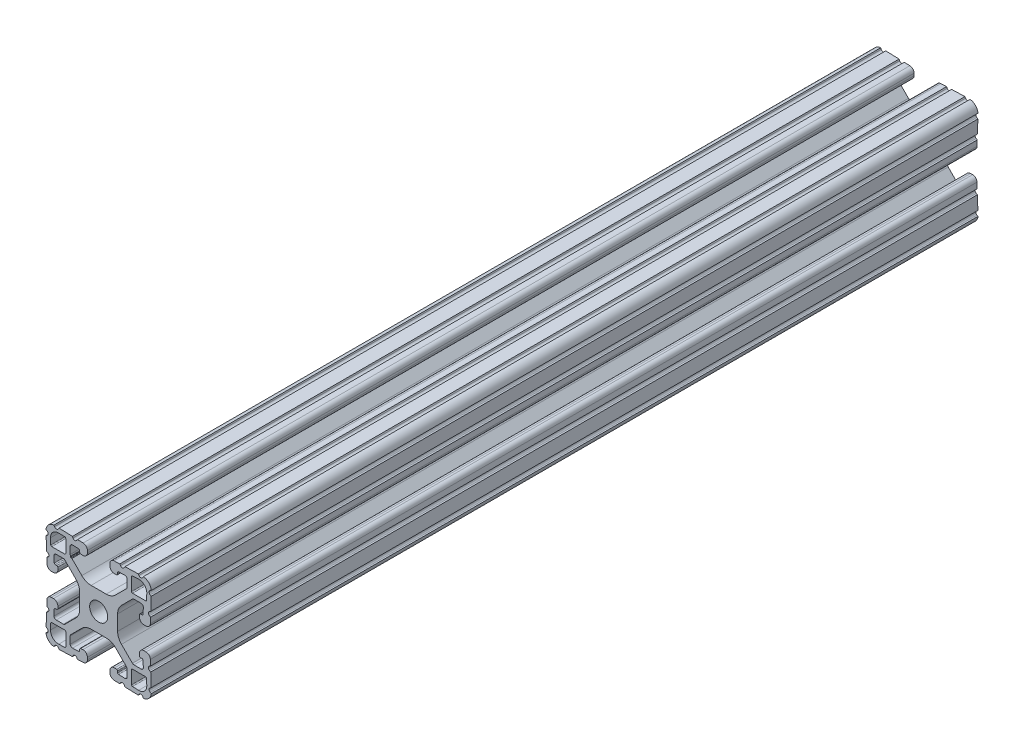
from build123d import *

# Parameters (mm, degrees)
BOSS_EXTRUDE1_DEPTH     = 149.44979
CUT_EXTRUDE2_DEPTH      = 152.858634035
CUT_EXTRUDE2_DEPTH_BACK = 152.858634035
CUT_EXTRUDE1_DEPTH      = 152.85562911
CUT_EXTRUDE1_DEPTH_BACK = 152.85562911


with BuildPart() as part:
    # Sketch4 → Boss-Extrude1 (new, symmetric)
    with BuildSketch(Plane.XY):
        with BuildLine():
            Line((15.764194098, -19.048065876), (5.596097049, -18.692988103))
            ThreePointArc((5.596097049, -18.692988103), (4.509548067, -18.209225328), (4.064, -17.106455165))
            Line((4.064, -17.106455165), (4.064, -16.343990692))
            ThreePointArc((4.064, -16.343990692), (4.548729837, -15.202038759), (5.706902951, -14.757457754))
            Line((5.706902951, -14.757457754), (6.490296708, -14.784814467))
            ThreePointArc((6.490296708, -14.784814467), (6.751068464, -14.900917533), (6.858, -15.165582372))
            Line((6.858, -15.165582372), (6.858, -15.689138401))
            ThreePointArc((6.858, -15.689138401), (6.964931536, -15.95380324), (7.225703292, -16.069906306))
            Line((7.225703292, -16.069906306), (9.465548524, -16.148123425))
            ThreePointArc((9.465548524, -16.148123425), (10.044635082, -15.925832923), (10.287, -15.354856956))
            Line((10.287, -15.354856956), (10.287, -12.771043484))
            ThreePointArc((10.287, -12.771043484), (10.226579379, -12.46728851), (10.054516008, -12.209777477))
            Line((10.054516008, -12.209777477), (6.093922742, -8.249184211))
            ThreePointArc((6.093922742, -8.249184211), (4.552976719, -7.219556996), (2.735306952, -6.858))
            Line((2.735306952, -6.858), (0, -6.858))
            Line((0, -6.858), (0, -3.2639))
            ThreePointArc((0, -3.2639), (2.307925823, -2.307925823), (3.2639, 0))
            Line((3.2639, 0), (6.858, 0))
            Line((6.858, 0), (6.858, -2.735306952))
            ThreePointArc((6.858, -2.735306952), (7.219556996, -4.552976719), (8.249184211, -6.093922742))
            Line((8.249184211, -6.093922742), (12.209777477, -10.054516008))
            ThreePointArc((12.209777477, -10.054516008), (12.46728851, -10.226579379), (12.771043484, -10.287))
            Line((12.771043484, -10.287), (15.354856956, -10.287))
            ThreePointArc((15.354856956, -10.287), (15.925832923, -10.044635082), (16.148123425, -9.465548524))
            Line((16.148123425, -9.465548524), (16.069906306, -7.225703292))
            ThreePointArc((16.069906306, -7.225703292), (15.95380324, -6.964931536), (15.689138401, -6.858))
            Line((15.689138401, -6.858), (15.165582372, -6.858))
            ThreePointArc((15.165582372, -6.858), (14.900917533, -6.751068464), (14.784814467, -6.490296708))
            Line((14.784814467, -6.490296708), (14.757457754, -5.706902951))
            ThreePointArc((14.757457754, -5.706902951), (15.202038759, -4.548729837), (16.343990692, -4.064))
            Line((16.343990692, -4.064), (17.106455165, -4.064))
            ThreePointArc((17.106455165, -4.064), (18.209225328, -4.509548067), (18.692988103, -5.596097049))
            Line((18.692988103, -5.596097049), (19.048065876, -15.764194098))
            ThreePointArc((19.048065876, -15.764194098), (18.12006403, -18.12006403), (15.764194098, -19.048065876))
        make_face()
        with BuildLine():
            Line((11.8872, -12.2682), (11.8872, -16.943575443))
            ThreePointArc((11.8872, -16.943575443), (11.994131536, -17.208240282), (12.254903292, -17.324343348))
            Line((12.254903292, -17.324343348), (14.445350862, -17.400835462))
            ThreePointArc((14.445350862, -17.400835462), (16.565633801, -16.565633801), (17.400835462, -14.445350862))
            Line((17.400835462, -14.445350862), (17.324343348, -12.254903292))
            ThreePointArc((17.324343348, -12.254903292), (17.208240282, -11.994131536), (16.943575443, -11.8872))
            Line((16.943575443, -11.8872), (12.2682, -11.8872))
            ThreePointArc((12.2682, -11.8872), (11.998792316, -11.998792316), (11.8872, -12.2682))
        make_face(mode=Mode.SUBTRACT)
    extrude(amount=BOSS_EXTRUDE1_DEPTH, both=True)

    # Sketch8 → Cut-Extrude2 (cut, two sides: drawn at the far end of the back side and taken through both)
    with BuildSketch(Plane.XY.offset(-CUT_EXTRUDE2_DEPTH_BACK)):
        with BuildLine():
            Line((7.649186899, -18.76468358), (9.495813101, -18.829169188))
            Line((9.495813101, -18.829169188), (9.278946369, -18.421302187))
            ThreePointArc((9.278946369, -18.421302187), (8.600423087, -17.997313783), (7.893976718, -18.372937981))
            Line((7.893976718, -18.372937981), (7.649186899, -18.76468358))
        make_face()
        with BuildLine():
            Line((14.316686899, -18.997517811), (16.163313101, -19.062003418))
            Line((16.163313101, -19.062003418), (15.946446369, -18.654136417))
            ThreePointArc((15.946446369, -18.654136417), (15.267923087, -18.230148014), (14.561476718, -18.605772211))
            Line((14.561476718, -18.605772211), (14.316686899, -18.997517811))
        make_face()
        with BuildLine():
            Line((18.605772211, -14.561476718), (18.997517811, -14.316686899))
            Line((18.997517811, -14.316686899), (19.062003418, -16.163313101))
            Line((19.062003418, -16.163313101), (18.654136417, -15.946446369))
            ThreePointArc((18.654136417, -15.946446369), (18.230148014, -15.267923087), (18.605772211, -14.561476718))
        make_face()
        with BuildLine():
            Line((18.372937981, -7.893976718), (18.76468358, -7.649186899))
            Line((18.76468358, -7.649186899), (18.829169188, -9.495813101))
            Line((18.829169188, -9.495813101), (18.421302187, -9.278946369))
            ThreePointArc((18.421302187, -9.278946369), (17.997313783, -8.600423087), (18.372937981, -7.893976718))
        make_face()
    extrude(amount=CUT_EXTRUDE2_DEPTH + CUT_EXTRUDE2_DEPTH_BACK, mode=Mode.SUBTRACT)

    # Mirror1: part across plane


with BuildPart() as part_1:
    add(part.part)
    add(part.part.mirror(Plane(origin=(0, 0, 0), x_dir=(0, 0, 1), z_dir=(1, 0, 0))))

    # Mirror2: part across plane


with BuildPart() as part_2:
    add(part_1.part)
    add(part_1.part.mirror(Plane.ZX))

    # Sketch5 → Cut-Extrude1 (cut, two sides: drawn at the far end of the back side and taken through both)
    with BuildSketch(Plane.XY.offset(-CUT_EXTRUDE1_DEPTH_BACK)):
        with BuildLine():
            Line((-10.133783723, 12.50797511), (-10.133783723, 11.99997511))
            ThreePointArc((-10.133783723, 11.99997511), (-10.084187138, 11.880238362), (-9.964450389, 11.830641777))
            Line((-9.964450389, 11.830641777), (-9.650582015, 11.830641777))
            Line((-9.650582015, 11.830641777), (-9.650582015, 12.50797511))
            Line((-9.650582015, 12.50797511), (-10.133783723, 12.50797511))
        make_face()
    extrude(amount=CUT_EXTRUDE1_DEPTH + CUT_EXTRUDE1_DEPTH_BACK, mode=Mode.SUBTRACT)


solid = part_2.part
